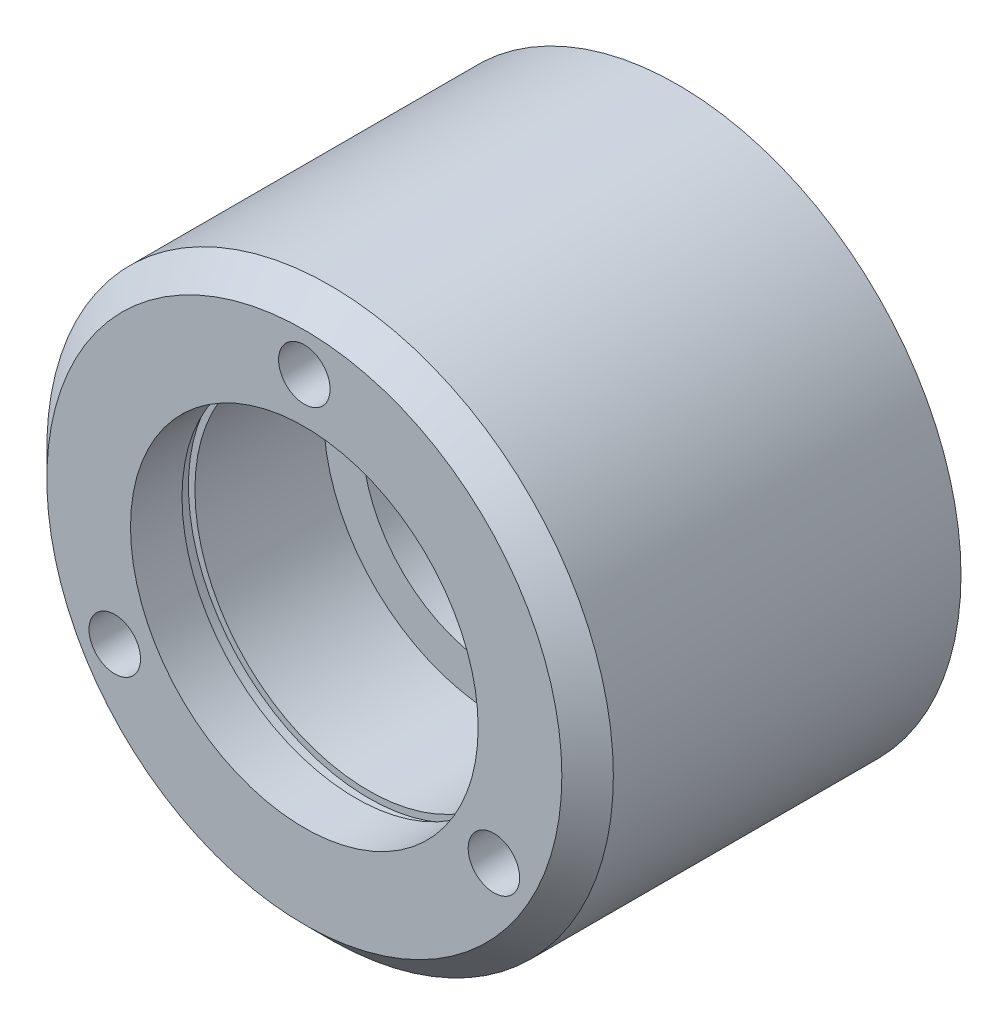
from build123d import *

# Parameters (mm, degrees)
ESQUISSE1_R                   = 11
ESQUISSE1_R_2                 = 5.25
BOSS_EXTRU_1_DEPTH            = 7
ESQUISSE2_R                   = 11
ESQUISSE2_R_2                 = 6.75
BOSS_EXTRU_2_DEPTH            = 5
ESQUISSE3_R                   = 11
ESQUISSE3_R_2                 = 7
BOSS_EXTRU_3_DEPTH            = 0.5
ESQUISSE4_R                   = 11
ESQUISSE4_R_2                 = 6.75
BOSS_EXTRU_4_DEPTH            = 2
CHANFREIN1_SIZE               = 1
DIAM_TRE_DU_PER_AGE_2_0_2_1_D = 2


with BuildPart() as part:
    # Esquisse1 → Boss.-Extru.1 (new body)
    with BuildSketch(Plane.XY):
        Circle(ESQUISSE1_R)
        Circle(ESQUISSE1_R_2, mode=Mode.SUBTRACT)
    extrude(amount=BOSS_EXTRU_1_DEPTH)

    # Esquisse2 → Boss.-Extru.2 (add)
    with BuildSketch(Plane.XY.offset(7)):
        Circle(ESQUISSE2_R)
        Circle(ESQUISSE2_R_2, mode=Mode.SUBTRACT)
    extrude(amount=BOSS_EXTRU_2_DEPTH)

    # Esquisse3 → Boss.-Extru.3 (add)
    with BuildSketch(Plane.XY.offset(12)):
        Circle(ESQUISSE3_R)
        Circle(ESQUISSE3_R_2, mode=Mode.SUBTRACT)
    extrude(amount=BOSS_EXTRU_3_DEPTH)

    # Esquisse4 → Boss.-Extru.4 (add)
    with BuildSketch(Plane.XY.offset(12.5)):
        Circle(ESQUISSE4_R)
        Circle(ESQUISSE4_R_2, mode=Mode.SUBTRACT)
    extrude(amount=BOSS_EXTRU_4_DEPTH)

    # Chanfrein1
    chanfrein1_edges = [part.edges().sort_by_distance(p)[0] for p in [
        (-11, 0, 14.5),
    ]]
    chamfer(chanfrein1_edges, length=CHANFREIN1_SIZE)

    # Diamètre du perçage Ø2.0 (2)1 (through all)
    with Locations(Plane(origin=(0, 0, 0), x_dir=(-1, 0, 0), z_dir=(0, 0, -1))):
        with Locations((-7.361215932, -4.25), (0, 8.5), (7.361215932, -4.25)):
            Hole(DIAM_TRE_DU_PER_AGE_2_0_2_1_D / 2)


solid = part.part
